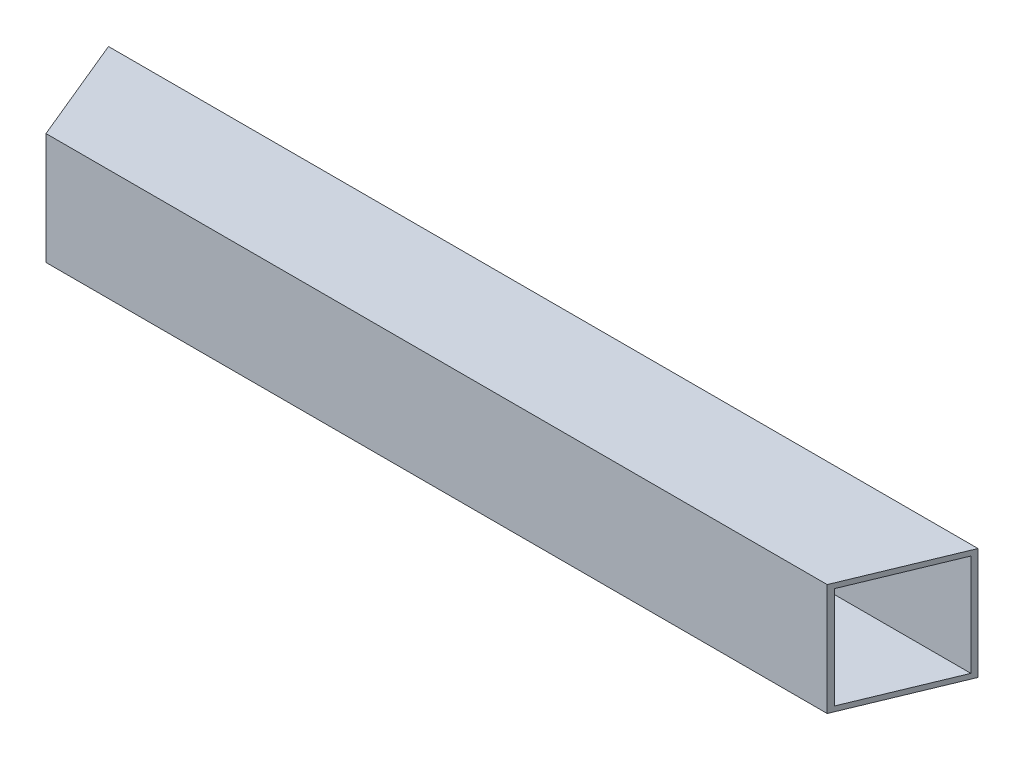
from build123d import *

# Parameters (mm, degrees)
BOSS_EXTRUDE1_DEPTH = 1.2
BOSS_EXTRUDE2_START = 25.4
BOSS_EXTRUDE2_DEPTH = 1.2
BOSS_EXTRUDE3_DEPTH = 24.2


with BuildPart() as part:
    # Sketch1 → Boss-Extrude1 (new body)
    with BuildSketch(Plane(origin=(0, 0, 0), x_dir=(1, 0, 0), z_dir=(0, 1, 0))):
        Polygon((-103.553390593, 250), (-93.032366109, 224.6), (93.032366109, 224.6), (103.553390593, 250), align=None)
    extrude(amount=BOSS_EXTRUDE1_DEPTH)



with BuildPart() as body_2:
    # Sketch2 → Boss-Extrude2 (new body)
    with BuildSketch(Plane(origin=(0, 1.2, 0), x_dir=(1, 0, 0), z_dir=(0, 1, 0)).offset(BOSS_EXTRUDE2_START)):
        Polygon((93.032366109, 224.6), (103.553390593, 250), (-103.553390593, 250), (-93.032366109, 224.6), align=None)
    extrude(amount=-BOSS_EXTRUDE2_DEPTH)


with BuildPart() as part_1:
    add(part.part)

    add(body_2.part)  # Boss-Extrude3 merges body 2
    # Sketch3 → Boss-Extrude3 (add)
    with BuildSketch(Plane(origin=(0, 1.2, 0), x_dir=(1, 0, 0), z_dir=(0, 1, 0))):
        Polygon((93.032366109, 224.6), (93.529422384, 225.8), (-93.529422384, 225.8), (-93.032366109, 224.6), align=None)
        Polygon((-103.553390593, 250), (-103.056334318, 248.8), (103.056334318, 248.8), (103.553390593, 250), align=None)
    extrude(amount=BOSS_EXTRUDE3_DEPTH)


solid = part_1.part
